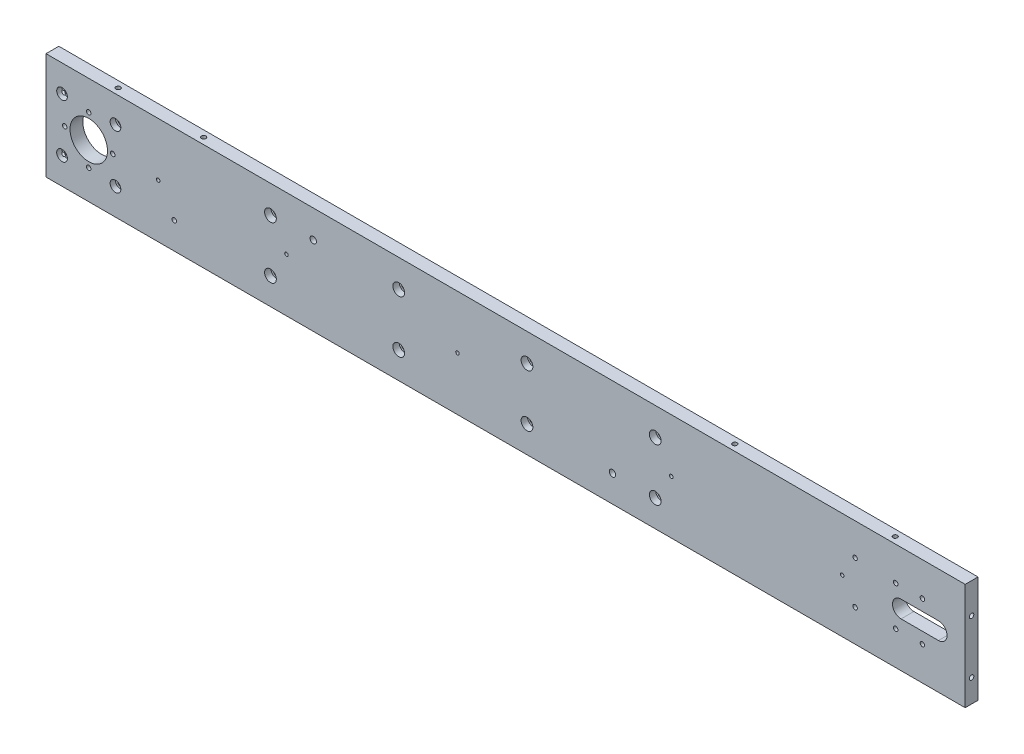
from build123d import *

# Parameters (mm, degrees)
SKETCH_1_W                     = 860
SKETCH_1_H                     = 100
EXTRUDE_1_DEPTH                = 12
SKETCH_2_R                     = 17.55
CUT_EXTRUDE_1_DEPTH            = 866.877589501
HOLE_WIZARD_M5_1_D             = 4.2
HOLE_WIZARD_M5_1_DEPTH         = 12.4
HOLE_WIZARD_M5_1_TIP           = 1.2618073
HOLE_WIZARD_M5_2_D             = 4.2
HOLE_WIZARD_M5_2_DEPTH         = 12.4
HOLE_WIZARD_M5_2_TIP           = 1.2618073
HOLE_WIZARD_M5_3_D             = 4.2
HOLE_WIZARD_M5_3_DEPTH         = 12.4
HOLE_WIZARD_M5_3_TIP           = 1.2618073
SKETCH_9_R                     = 3
CUT_EXTRUDE_2_DEPTH            = 866.877589501
HOLE_WIZARD_M6_1_D             = 7
HOLE_WIZARD_M6_1_CBORE_D       = 11
HOLE_WIZARD_M6_1_CBORE_DEPTH   = 6
HOLE_WIZARD_M4_1_D             = 3.3
HOLE_WIZARD_M4_1_DEPTH         = 10.1
HOLE_WIZARD_M4_1_TIP           = 0.991420021
HOLE_WIZARD_M5_4_D             = 4.2
HOLE_WIZARD_M5_4_DEPTH         = 12.4
HOLE_WIZARD_M5_4_TIP           = 1.2618073
HOLE_WIZARD_M5_5_D             = 4.2
HOLE_WIZARD_M5_5_DEPTH         = 12.4
HOLE_WIZARD_M5_5_TIP           = 1.2618073
HOLE_WIZARD_M5_1_2_D           = 5.8
HOLE_WIZARD_M5_1_2_CBORE_D     = 10
HOLE_WIZARD_M5_1_2_CBORE_DEPTH = 5
HOLE_WIZARD_M5_6_D             = 4.2
HOLE_WIZARD_M5_6_DEPTH         = 12.4
HOLE_WIZARD_M5_6_TIP           = 1.2618073
HOLE_WIZARD_M5_7_D             = 4.2
HOLE_WIZARD_M5_7_DEPTH         = 12.4
HOLE_WIZARD_M5_7_TIP           = 1.2618073
HOLE_WIZARD_M3_1_D             = 2.5
HOLE_WIZARD_M3_1_DEPTH         = 7.5
HOLE_WIZARD_M3_1_TIP           = 0.751075774


with BuildPart() as part:
    # 草图1 → 凸台-拉伸1 (new body)
    with BuildSketch(Plane.XY):
        with Locations((430, 50)):
            Rectangle(SKETCH_1_W, SKETCH_1_H)
    extrude(amount=EXTRUDE_1_DEPTH)

    # 草图2 → 切除-拉伸1 (cut, through all)
    with BuildSketch(Plane.XY.offset(12)):
        with Locations((40, 50)):
            Circle(SKETCH_2_R)
        with BuildLine():
            Line((800, 58), (835, 58))
            ThreePointArc((835, 58), (843, 50), (835, 42))
            Line((835, 42), (800, 42))
            ThreePointArc((800, 42), (792, 50), (800, 58))
        make_face()
    extrude(amount=-CUT_EXTRUDE_1_DEPTH, mode=Mode.SUBTRACT)

    # Hole Wizard M5 _1
    with Locations(Plane(origin=(0, 100, 0), x_dir=(-1, 0, 0), z_dir=(0, 1, 0))):
        with Locations((-141.5, 6), (-61.5, 6), (-788.5, 6), (-638.5, 6)):
            Hole(HOLE_WIZARD_M5_1_D / 2, depth=HOLE_WIZARD_M5_1_DEPTH)
            with Locations((0, 0, -(HOLE_WIZARD_M5_1_DEPTH + HOLE_WIZARD_M5_1_TIP / 2))):  # 118° drill point
                Cone(0, HOLE_WIZARD_M5_1_D / 2, HOLE_WIZARD_M5_1_TIP, mode=Mode.SUBTRACT)

    # M5 螺纹孔2
    with Locations(Plane.ZY):
        with Locations((6, 71.5), (6, 21.5)):
            Hole(HOLE_WIZARD_M5_2_D / 2, depth=HOLE_WIZARD_M5_2_DEPTH)
            with Locations((0, 0, -(HOLE_WIZARD_M5_2_DEPTH + HOLE_WIZARD_M5_2_TIP / 2))):  # 118° drill point
                Cone(0, HOLE_WIZARD_M5_2_D / 2, HOLE_WIZARD_M5_2_TIP, mode=Mode.SUBTRACT)

    # M5 螺纹孔3
    with Locations(Plane(origin=(860, 0, 0), x_dir=(0, 0, -1), z_dir=(1, 0, 0))):
        with Locations((-6, 71.5), (-6, 21.5)):
            Hole(HOLE_WIZARD_M5_3_D / 2, depth=HOLE_WIZARD_M5_3_DEPTH)
            with Locations((0, 0, -(HOLE_WIZARD_M5_3_DEPTH + HOLE_WIZARD_M5_3_TIP / 2))):  # 118° drill point
                Cone(0, HOLE_WIZARD_M5_3_D / 2, HOLE_WIZARD_M5_3_TIP, mode=Mode.SUBTRACT)

    # 草图9 → 切除-拉伸2 (cut, through all)
    with BuildSketch(Plane.XY.offset(12)):
        with Locations((250, 74)):
            Circle(SKETCH_9_R)
        with Locations((530, 25)):
            Circle(SKETCH_9_R)
    extrude(amount=-CUT_EXTRUDE_2_DEPTH, mode=Mode.SUBTRACT)

    # M6 六角凹头螺钉的柱形沉头孔1 (through all)
    with Locations(Plane.XY.offset(12)):
        with Locations((210, 74), (330, 74), (450, 74), (570, 74), (570, 25), (450, 25), (330, 25), (210, 25)):
            CounterBoreHole(HOLE_WIZARD_M6_1_D / 2, HOLE_WIZARD_M6_1_CBORE_D / 2, HOLE_WIZARD_M6_1_CBORE_DEPTH)

    # M4 螺纹孔1
    with Locations(Plane.XY.offset(12)):
        with Locations((225, 50), (105, 50), (385, 50), (745, 50), (585, 50)):
            Hole(HOLE_WIZARD_M4_1_D / 2, depth=HOLE_WIZARD_M4_1_DEPTH)
            with Locations((0, 0, -(HOLE_WIZARD_M4_1_DEPTH + HOLE_WIZARD_M4_1_TIP / 2))):  # 118° drill point
                Cone(0, HOLE_WIZARD_M4_1_D / 2, HOLE_WIZARD_M4_1_TIP, mode=Mode.SUBTRACT)

    # M5 螺纹孔4
    with Locations(Plane(origin=(0, 0, 0), x_dir=(-1, 0, 0), z_dir=(0, 0, -1))):
        with Locations((-757, 70), (-757, 30)):
            Hole(HOLE_WIZARD_M5_4_D / 2, depth=HOLE_WIZARD_M5_4_DEPTH)
            with Locations((0, 0, -(HOLE_WIZARD_M5_4_DEPTH + HOLE_WIZARD_M5_4_TIP / 2))):  # 118° drill point
                Cone(0, HOLE_WIZARD_M5_4_D / 2, HOLE_WIZARD_M5_4_TIP, mode=Mode.SUBTRACT)

    # M5 螺纹孔5
    with Locations(Plane(origin=(0, 0, 0), x_dir=(-1, 0, 0), z_dir=(0, 0, -1))):
        with Locations((-795, 68.5), (-820, 68.5), (-795, 31.5), (-820, 31.5)):
            Hole(HOLE_WIZARD_M5_5_D / 2, depth=HOLE_WIZARD_M5_5_DEPTH)
            with Locations((0, 0, -(HOLE_WIZARD_M5_5_DEPTH + HOLE_WIZARD_M5_5_TIP / 2))):  # 118° drill point
                Cone(0, HOLE_WIZARD_M5_5_D / 2, HOLE_WIZARD_M5_5_TIP, mode=Mode.SUBTRACT)

    # Hole Wizard M5 _1 2 (through all)
    with Locations(Plane.XY.offset(12)):
        with Locations((15, 25), (15, 75), (65, 75), (65, 25)):
            CounterBoreHole(HOLE_WIZARD_M5_1_2_D / 2, HOLE_WIZARD_M5_1_2_CBORE_D / 2, HOLE_WIZARD_M5_1_2_CBORE_DEPTH)

    # M5 螺纹孔6
    with Locations(Plane(origin=(0, 0, 0), x_dir=(-1, 0, 0), z_dir=(0, 0, -1))):
        with Locations((-17.5, 50), (-40, 27.5), (-40, 72.5), (-62.5, 50)):
            Hole(HOLE_WIZARD_M5_6_D / 2, depth=HOLE_WIZARD_M5_6_DEPTH)
            with Locations((0, 0, -(HOLE_WIZARD_M5_6_DEPTH + HOLE_WIZARD_M5_6_TIP / 2))):  # 118° drill point
                Cone(0, HOLE_WIZARD_M5_6_D / 2, HOLE_WIZARD_M5_6_TIP, mode=Mode.SUBTRACT)

    # M5 螺纹孔7
    with Locations(Plane(origin=(0, 0, 0), x_dir=(-1, 0, 0), z_dir=(0, 0, -1))):
        with Locations((-120, 25)):
            Hole(HOLE_WIZARD_M5_7_D / 2, depth=HOLE_WIZARD_M5_7_DEPTH)
            with Locations((0, 0, -(HOLE_WIZARD_M5_7_DEPTH + HOLE_WIZARD_M5_7_TIP / 2))):  # 118° drill point
                Cone(0, HOLE_WIZARD_M5_7_D / 2, HOLE_WIZARD_M5_7_TIP, mode=Mode.SUBTRACT)

    # M3 螺纹孔1
    with Locations(Plane.XZ):
        with Locations((120, 6), (140, 6), (160, 6), (680, 6), (700, 6), (720, 6), (90, 6), (70, 6)):
            Hole(HOLE_WIZARD_M3_1_D / 2, depth=HOLE_WIZARD_M3_1_DEPTH)
            with Locations((0, 0, -(HOLE_WIZARD_M3_1_DEPTH + HOLE_WIZARD_M3_1_TIP / 2))):  # 118° drill point
                Cone(0, HOLE_WIZARD_M3_1_D / 2, HOLE_WIZARD_M3_1_TIP, mode=Mode.SUBTRACT)


solid = part.part
